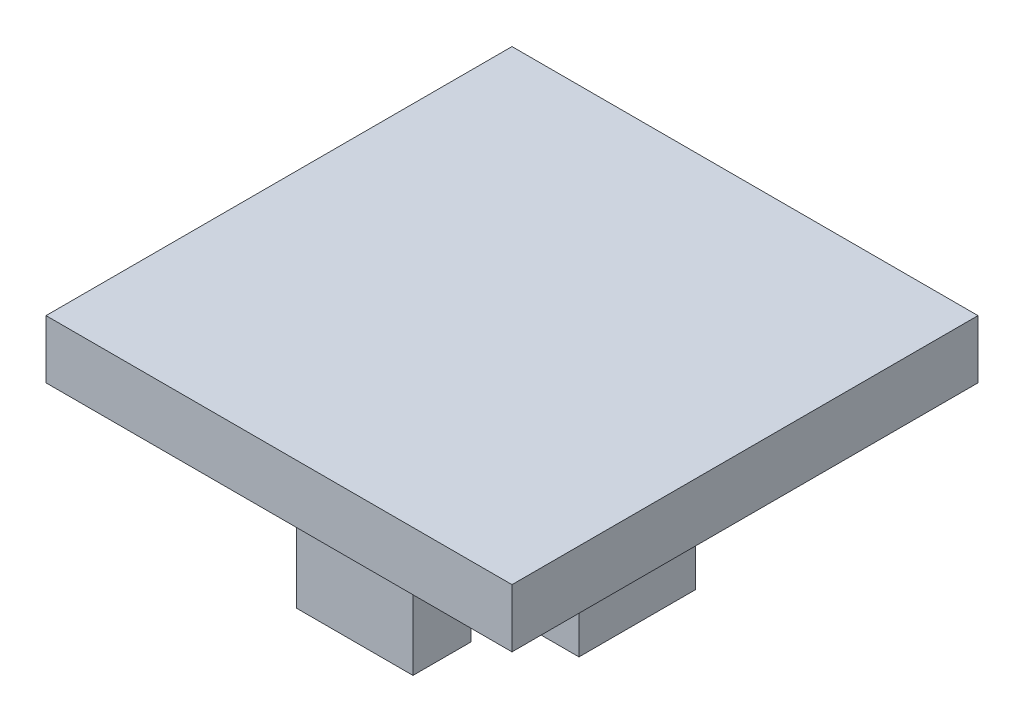
from build123d import *

# Parameters (mm, degrees)
SKETCH1_W                = 8
SKETCH1_H                = 8
BOSS_EXTRUDE1_DEPTH      = 1
SKETCH2_W                = 2
SKETCH2_H                = 1
SKETCH2_W_2              = 1
SKETCH2_H_2              = 2
BOSS_EXTRUDE2_DEPTH      = 2.5
SKETCH3_W                = 2
SKETCH3_H                = 0.5
BOSS_EXTRUDE3_DEPTH      = 0.5
CHAMFER2_SIZE            = 0.3
CHAMFER2_OF_MIRROR2_SIZE = 0.3
FILLET1_R                = 1


with BuildPart() as part:
    # Sketch1 → Boss-Extrude1 (new body)
    with BuildSketch(Plane(origin=(0, 0, 0), x_dir=(1, 0, 0), z_dir=(0, 1, 0))):
        Rectangle(SKETCH1_W, SKETCH1_H)
    extrude(amount=BOSS_EXTRUDE1_DEPTH)

    # Sketch2 → Boss-Extrude2 (add)
    with BuildSketch(Plane.XZ):
        with Locations((0, 2.2)):
            Rectangle(SKETCH2_W, SKETCH2_H)
        with Locations((1.65, 0)):
            Rectangle(SKETCH2_W_2, SKETCH2_H_2)
    boss_extrude2 = extrude(amount=BOSS_EXTRUDE2_DEPTH)

    # Sketch3 → Boss-Extrude3 (add)
    with BuildSketch(Plane(origin=(0, 0, 1.7), x_dir=(-1, 0, 0), z_dir=(0, 0, -1))):
        with Locations((0, -1.75)):
            Rectangle(SKETCH3_W, SKETCH3_H)
    boss_extrude3 = extrude(amount=BOSS_EXTRUDE3_DEPTH)

    # Chamfer2
    chamfer2_edges = [part.edges().sort_by_distance(p)[0] for p in [
        (0, -2, 1.2),
    ]]
    chamfer(chamfer2_edges, length=CHAMFER2_SIZE)

    # Mirror1: Boss-Extrude2 across plane
    add(boss_extrude2.mirror(Plane(origin=(0, 0, 0), x_dir=(0, 0, 1), z_dir=(1, 0, 0))))

    # Mirror2: Boss-Extrude2, Boss-Extrude3 across plane
    add(boss_extrude2.mirror(Plane.XY))
    add(boss_extrude3.mirror(Plane.XY))

    # Chamfer2 of Mirror2
    chamfer2_of_mirror2_edges = [part.edges().sort_by_distance(p)[0] for p in [
        (0, -2, -1.2),
    ]]
    chamfer(chamfer2_of_mirror2_edges, length=CHAMFER2_OF_MIRROR2_SIZE)

    # Fillet1
    fillet1_edges = [part.edges().sort_by_distance(p)[0] for p in [
        (0, 0, 2.7),
        (2.15, 0, 0),
        (-2.15, 0, 0),
        (0, 0, -2.7),
    ]]
    fillet(fillet1_edges, radius=FILLET1_R)


solid = part.part
